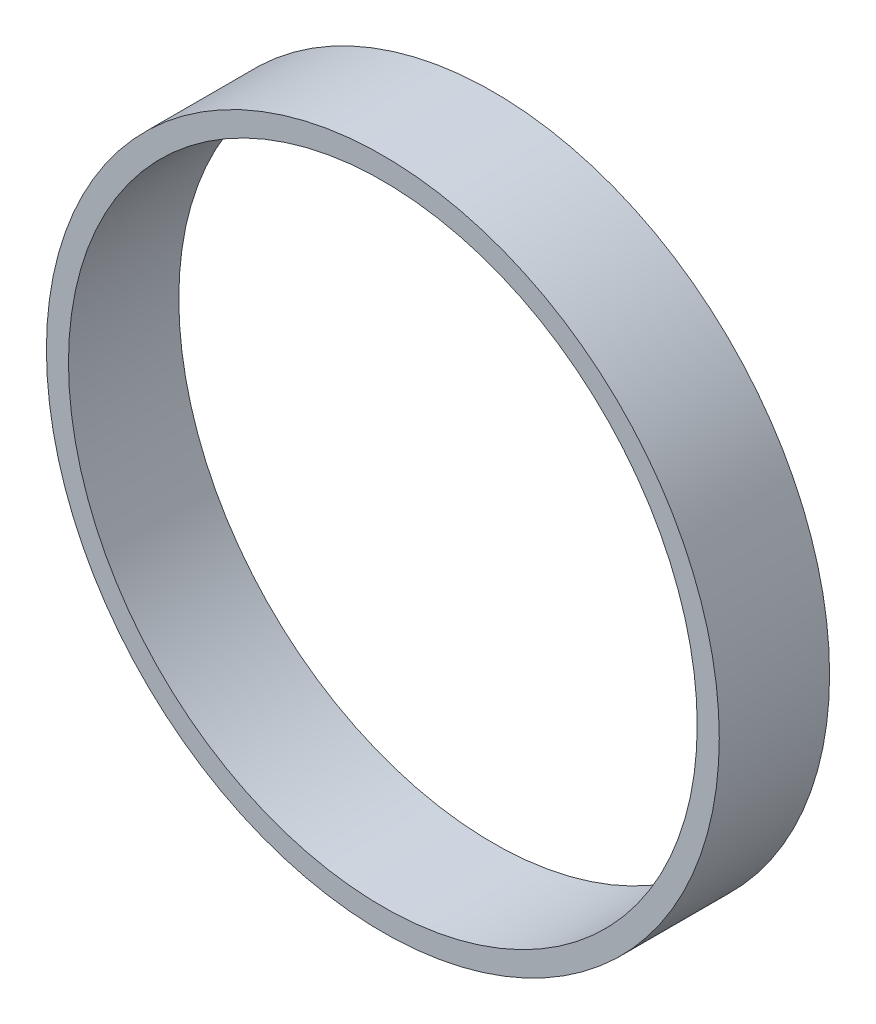
from build123d import *

# Parameters (mm, degrees)
ESBO_O1_R                = 30.5
ESBO_O1_R_2              = 28.5
RESSALTO_EXTRUS_O1_DEPTH = 10


with BuildPart() as part:
    # Esboço1 → Ressalto-extrusão1 (new body)
    with BuildSketch(Plane.XY):
        Circle(ESBO_O1_R)
        Circle(ESBO_O1_R_2, mode=Mode.SUBTRACT)
    extrude(amount=RESSALTO_EXTRUS_O1_DEPTH)


solid = part.part
